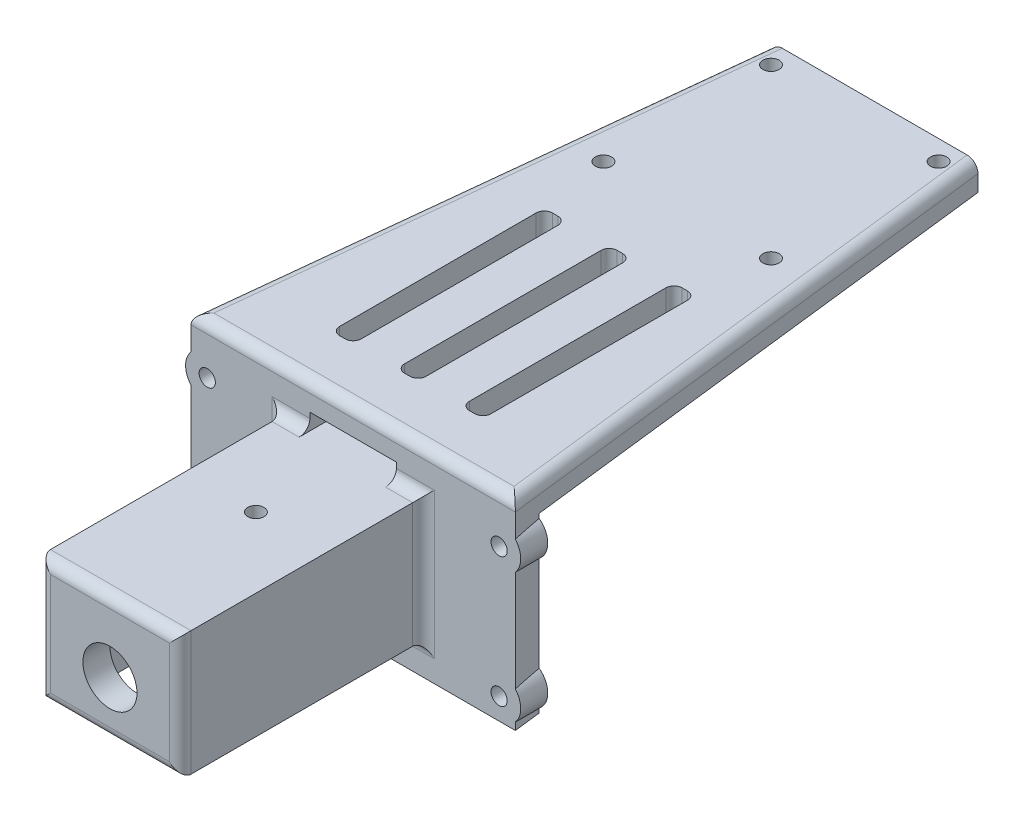
from build123d import *

# Parameters (mm, degrees)
SKETCH1_W           = 60
SKETCH1_H           = 32
BOSS_EXTRUDE1_DEPTH = 5
SKETCH2_R           = 1.5
CUT_EXTRUDE1_DEPTH  = 5
SKETCH4_R           = 5
CUT_EXTRUDE2_DEPTH  = 5
SKETCH5_W           = 60
SKETCH5_H           = 5
BOSS_EXTRUDE2_DEPTH = 97
SKETCH6_R           = 1.5
CUT_EXTRUDE3_DEPTH  = 100
CUT_EXTRUDE4_DEPTH  = 100
BOSS_EXTRUDE3_DEPTH = 45
SKETCH9_W           = 26
SKETCH9_H           = 23
BOSS_EXTRUDE4_DEPTH = 5
SKETCH10_R          = 5
CUT_EXTRUDE5_DEPTH  = 5
SKETCH17_W          = 16
SKETCH17_H          = 3
CUT_EXTRUDE6_DEPTH  = 10
SKETCH18_R          = 1.5
CUT_EXTRUDE7_DEPTH  = 10
FILLET3_R           = 2
FILLET4_R           = 2
FILLET5_R           = 2
SKETCH34_R          = 4
SKETCH34_R_2        = 1.5
BOSS_EXTRUDE5_DEPTH = 5
SKETCH36_R          = 4
SKETCH36_R_2        = 1.5
BOSS_EXTRUDE6_DEPTH = 5
SKETCH37_R          = 4
SKETCH37_R_2        = 1.5
BOSS_EXTRUDE7_DEPTH = 5
SKETCH38_R          = 4
SKETCH38_R_2        = 1.5
BOSS_EXTRUDE8_DEPTH = 5
SKETCH40_W          = 4
SKETCH40_H          = 39.348212258
CUT_EXTRUDE8_DEPTH  = 10
FILLET6_R           = 1.5
SKETCH43_R          = 1.5
CUT_EXTRUDE10_DEPTH = 9


with BuildPart() as part:
    # Sketch1 → Boss-Extrude1 (new body)
    with BuildSketch(Plane.XY):
        Rectangle(SKETCH1_W, SKETCH1_H)
    extrude(amount=BOSS_EXTRUDE1_DEPTH)

    # Sketch2 → Cut-Extrude1 (cut)
    with BuildSketch(Plane.XY.offset(5)):
        with Locations((27, 12)):
            Circle(SKETCH2_R)
        with Locations((27, -12)):
            Circle(SKETCH2_R)
        with Locations((-27, -12)):
            Circle(SKETCH2_R)
        with Locations((-27, 12)):
            Circle(SKETCH2_R)
    extrude(amount=-CUT_EXTRUDE1_DEPTH, mode=Mode.SUBTRACT)

    # Sketch4 → Cut-Extrude2 (cut)
    with BuildSketch(Plane.XY.offset(5)):
        Circle(SKETCH4_R)
    extrude(amount=-CUT_EXTRUDE2_DEPTH, mode=Mode.SUBTRACT)

    # Sketch5 → Boss-Extrude2 (add)
    with BuildSketch(Plane.XY.offset(5)):
        with Locations((0, 18.5)):
            Rectangle(SKETCH5_W, SKETCH5_H)
    extrude(amount=-BOSS_EXTRUDE2_DEPTH)

    # Sketch6 → Cut-Extrude3 (cut)
    with BuildSketch(Plane.XZ.offset(-16)):
        with Locations(Location((15, -57.3, 0), (0, 0, 270))):
            Circle(SKETCH6_R)
        with Locations(Location((-16, -57.3, 0), (0, 0, 270))):
            Circle(SKETCH6_R)
        with Locations(Location((15, -88.3, 0), (0, 0, 270))):
            Circle(SKETCH6_R)
        with Locations(Location((-16, -88.3, 0), (0, 0, 270))):
            Circle(SKETCH6_R)
    extrude(amount=-CUT_EXTRUDE3_DEPTH, mode=Mode.SUBTRACT)

    # Sketch7 → Cut-Extrude4 (cut)
    with BuildSketch(Plane(origin=(0, 21, 0), x_dir=(1, 0, 0), z_dir=(0, 1, 0))):
        Polygon((30, -5), (18.592432289, 92), (30, 92), align=None)
        Polygon((-30, -5), (-19.627140112, 92), (-30, 92), align=None)
    extrude(amount=-CUT_EXTRUDE4_DEPTH, mode=Mode.SUBTRACT)

    # Sketch8 → Boss-Extrude3 (add)
    with BuildSketch(Plane.XY.offset(5)):
        Polygon((13, 13), (-13, 13), (-13, -10), (-10, -10), (-10, 10), (10, 10), (10, -10), (13, -10), align=None)
    extrude(amount=BOSS_EXTRUDE3_DEPTH)

    # Sketch9 → Boss-Extrude4 (add)
    with BuildSketch(Plane.XY.offset(50)):
        with Locations((0, 1.5)):
            Rectangle(SKETCH9_W, SKETCH9_H)
    extrude(amount=-BOSS_EXTRUDE4_DEPTH)

    # Sketch10 → Cut-Extrude5 (cut)
    with BuildSketch(Plane.XY.offset(50)):
        Circle(SKETCH10_R)
    extrude(amount=-CUT_EXTRUDE5_DEPTH, mode=Mode.SUBTRACT)

    # Sketch17 → Cut-Extrude6 (cut)
    with BuildSketch(Plane.XY.offset(5)):
        with Locations((0, 14.5)):
            Rectangle(SKETCH17_W, SKETCH17_H)
    extrude(amount=-CUT_EXTRUDE6_DEPTH, mode=Mode.SUBTRACT)

    # Sketch18 → Cut-Extrude7 (cut)
    with BuildSketch(Plane(origin=(0, 13, 0), x_dir=(1, 0, 0), z_dir=(0, 1, 0))):
        with Locations(Location((0, -23, 0), (0, 0, 180))):
            Circle(SKETCH18_R)
    extrude(amount=-CUT_EXTRUDE7_DEPTH, mode=Mode.SUBTRACT)

    # Fillet3
    fillet3_edges = [part.edges().sort_by_distance(p)[0] for p in [
        (0, 21, 5),
        (24.296216145, 21, -43.5),
        (-24.813570056, 21, -43.5),
    ]]
    fillet(fillet3_edges, radius=FILLET3_R)

    # Fillet4
    fillet4_edges = [part.edges().sort_by_distance(p)[0] for p in [
        (0, -10, 50),
        (13, 1.5, 50),
        (0, 13, 50),
        (-13, 1.5, 50),
    ]]
    fillet(fillet4_edges, radius=FILLET4_R)

    # Fillet5
    fillet5_edges = [part.edges().sort_by_distance(p)[0] for p in [
        (11.5, -10, 5),
        (13, 1.5, 5),
        (10.5, 13, 5),
        (-13, 1.5, 5),
        (-11.5, -10, 5),
        (-10.5, 13, 5),
    ]]
    fillet(fillet5_edges, radius=FILLET5_R)

    # Sketch34 → Boss-Extrude5 (add)
    with BuildSketch(Plane.XY.offset(5)):
        with Locations((-27, 12)):
            Circle(SKETCH34_R)
        with Locations((-27, 12)):
            Circle(SKETCH34_R_2, mode=Mode.SUBTRACT)
    extrude(amount=-BOSS_EXTRUDE5_DEPTH)

    # Sketch36 → Boss-Extrude6 (add)
    with BuildSketch(Plane.XY.offset(5)):
        with Locations((-27, -12)):
            Circle(SKETCH36_R)
        with Locations((-27, -12)):
            Circle(SKETCH36_R_2, mode=Mode.SUBTRACT)
    extrude(amount=-BOSS_EXTRUDE6_DEPTH)

    # Sketch37 → Boss-Extrude7 (add)
    with BuildSketch(Plane.XY.offset(5)):
        with Locations((27, 12)):
            Circle(SKETCH37_R)
        with Locations((27, 12)):
            Circle(SKETCH37_R_2, mode=Mode.SUBTRACT)
    extrude(amount=-BOSS_EXTRUDE7_DEPTH)

    # Sketch38 → Boss-Extrude8 (add)
    with BuildSketch(Plane.XY.offset(5)):
        with Locations((27, -12)):
            Circle(SKETCH38_R)
        with Locations((27, -12)):
            Circle(SKETCH38_R_2, mode=Mode.SUBTRACT)
    extrude(amount=-BOSS_EXTRUDE8_DEPTH)

    # Sketch40 → Cut-Extrude8 (cut)
    with BuildSketch(Plane(origin=(0, 21, 0), x_dir=(1, 0, 0), z_dir=(0, 1, 0))):
        with Locations((12, 24.674106129)):
            Rectangle(SKETCH40_W, SKETCH40_H)
        with Locations((0, 24.674106129)):
            Rectangle(SKETCH40_W, SKETCH40_H)
        with Locations((-12, 24.674106129)):
            Rectangle(SKETCH40_W, SKETCH40_H)
    extrude(amount=-CUT_EXTRUDE8_DEPTH, mode=Mode.SUBTRACT)

    # Fillet6
    fillet6_edges = [part.edges().sort_by_distance(p)[0] for p in [
        (-10, 18.5, -5),
        (-14, 18.5, -5),
        (-14, 18.5, -44.348212258),
        (-10, 18.5, -44.348212258),
        (2, 18.5, -5),
        (-2, 18.5, -5),
        (-2, 18.5, -44.348212258),
        (2, 18.5, -44.348212258),
        (14, 18.5, -5),
        (10, 18.5, -5),
        (10, 18.5, -44.348212258),
        (14, 18.5, -44.348212258),
    ]]
    fillet(fillet6_edges, radius=FILLET6_R)

    # Sketch43 → Cut-Extrude10 (cut)
    with BuildSketch(Plane.ZY.offset(13)):
        with Locations((40, 1.5)):
            Circle(SKETCH43_R)
    extrude(amount=-CUT_EXTRUDE10_DEPTH, mode=Mode.SUBTRACT)


solid = part.part
